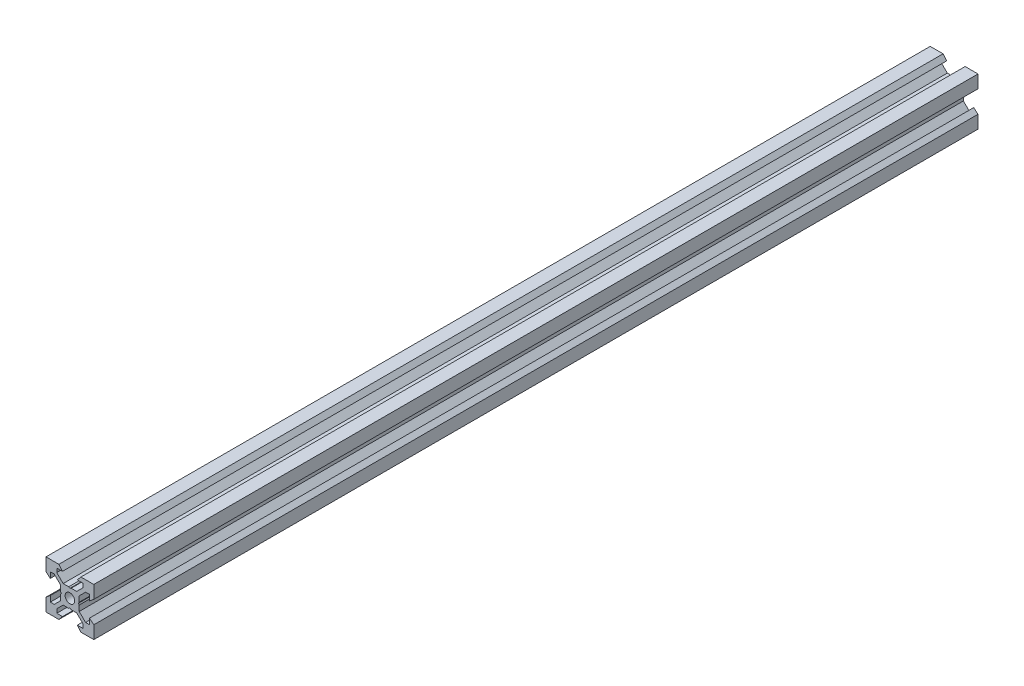
from build123d import *

# Parameters (mm, degrees)
SKETCH1_R           = 2
BOSS_EXTRUDE1_DEPTH = 185


with BuildPart() as part:
    # Sketch1 → Boss-Extrude1 (new, symmetric)
    with BuildSketch(Plane.XY):
        Polygon((10, 10), (10, 4.610379336), (8.2, 3.1), (8.2, 5.5), (6.560660172, 5.5), (3.9, 2.839339828), (3.9, 0.519615242), (3.6, 0), (3.9, -0.519615242), (3.9, -2.839339828), (6.560660172, -5.5), (8.2, -5.5), (8.2, -3.1), (10, -4.610379336), (10, -10), (4.610379336, -10), (3.1, -8.2), (5.5, -8.2), (5.5, -6.560660172), (2.839339828, -3.9), (0.519615242, -3.9), (0, -3.6), (-0.519615242, -3.9), (-2.839339828, -3.9), (-5.5, -6.560660172), (-5.5, -8.2), (-3.1, -8.2), (-4.610379336, -10), (-10, -10), (-10, -4.610379336), (-8.2, -3.1), (-8.2, -5.5), (-6.560660172, -5.5), (-3.9, -2.839339828), (-3.9, -0.519615242), (-3.6, 0), (-3.9, 0.519615242), (-3.9, 2.839339828), (-6.560660172, 5.5), (-8.2, 5.5), (-8.2, 3.1), (-10, 4.610379336), (-10, 10), (-4.610379336, 10), (-3.1, 8.2), (-5.5, 8.2), (-5.5, 6.560660172), (-2.839339828, 3.9), (-0.519615242, 3.9), (0, 3.6), (0.519615242, 3.9), (2.839339828, 3.9), (5.5, 6.560660172), (5.5, 8.2), (3.1, 8.2), (4.610379336, 10), align=None)
        Circle(SKETCH1_R, mode=Mode.SUBTRACT)
    extrude(amount=BOSS_EXTRUDE1_DEPTH, both=True)


solid = part.part
